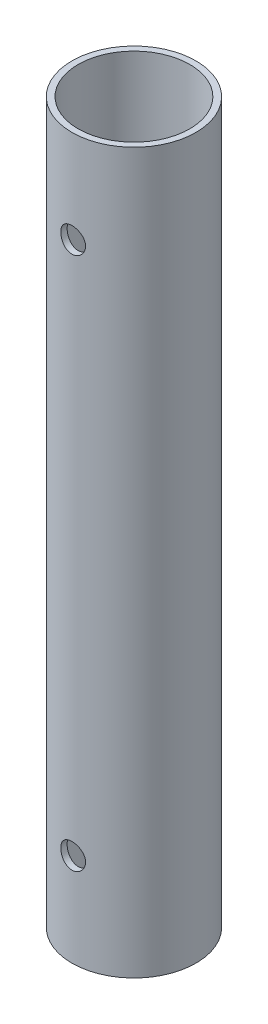
from build123d import *

# Parameters (mm, degrees)
CROQUIS1_R                 = 10
CROQUIS1_R_2               = 9
SALIENTE_EXTRUIR1_DEPTH    = 58
CORTAR_EXTRUIR1_DEPTH      = 60.699246226
CORTAR_EXTRUIR1_DEPTH_BACK = 60.699246226
CROQUIS2_R                 = 2


with BuildPart() as part:
    # Croquis1 → Saliente-Extruir1 (new, symmetric)
    with BuildSketch(Plane(origin=(0, 0, 0), x_dir=(1, 0, 0), z_dir=(0, 1, 0))):
        with Locations(Location((0, 0, 0), (0, 0, 90))):
            Circle(CROQUIS1_R)
        with Locations(Location((0, 0, 0), (0, 0, 90))):
            Circle(CROQUIS1_R_2, mode=Mode.SUBTRACT)
    extrude(amount=SALIENTE_EXTRUIR1_DEPTH, both=True)

    # Croquis2 → Cortar-Extruir1 (cut, two sides: drawn at the far end of the back side and taken through both)
    with BuildSketch(Plane.XY.offset(-CORTAR_EXTRUIR1_DEPTH_BACK)):
        with Locations((0, -43)):
            Circle(CROQUIS2_R)
        with Locations((0, 43)):
            Circle(CROQUIS2_R)
    extrude(amount=CORTAR_EXTRUIR1_DEPTH + CORTAR_EXTRUIR1_DEPTH_BACK, mode=Mode.SUBTRACT)


solid = part.part
